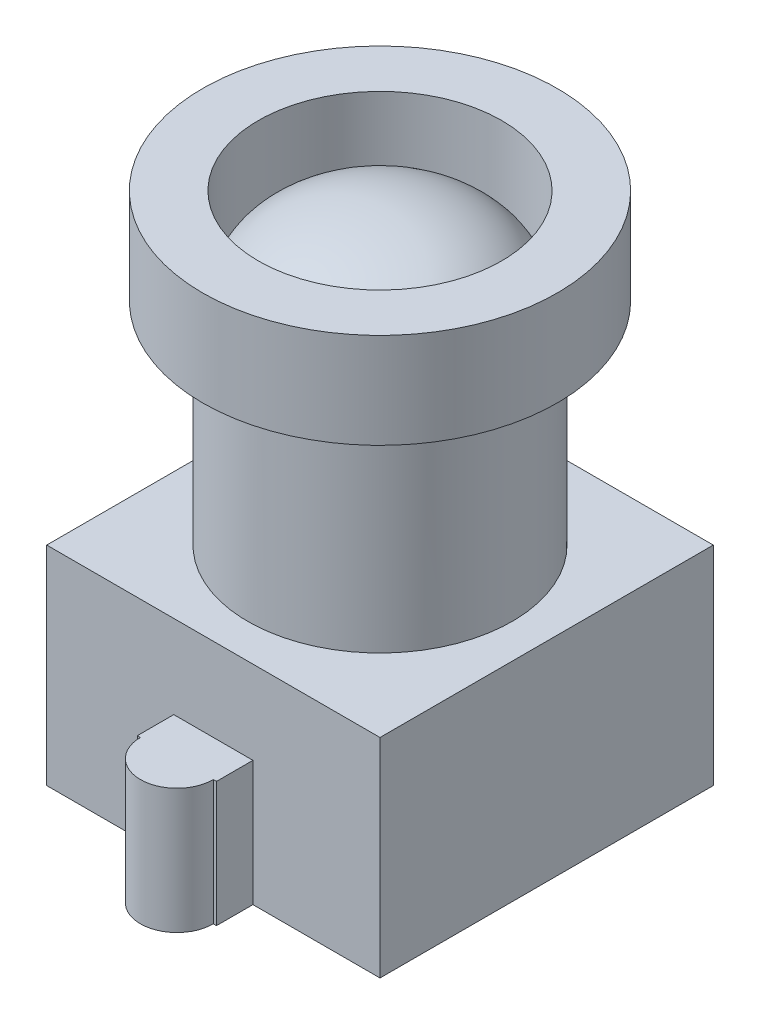
from build123d import *

# Parameters (mm, degrees)
SKETCH1_W               = 16
SKETCH1_H               = 16
CCD_BASE_DEPTH          = 10
CCD_BASE_MOUNT_DEPTH    = 6
SKETCH5_R               = 6.35
LENSE_TUBE_DEPTH        = 10.16
SKETCH6_R               = 8.509
SKETCH6_R_2             = 5.842
LENSE_RIM_DEPTH         = 4.572
LENSE_GLASS_FACE_RADIUS = 5.842
LENSE_GLASS_HEIGHT      = 3.81


with BuildPart() as part:
    # Sketch1 → ccd_base (new body)
    with BuildSketch(Plane.XZ.offset(-1.6)):
        Rectangle(SKETCH1_W, SKETCH1_H)
    extrude(amount=-CCD_BASE_DEPTH)

    # Sketch2 → ccd_base_mount (add)
    with BuildSketch(Plane.XZ.offset(-1.6)):
        with BuildLine():
            Line((1.9, 9.75), (1.75, 9.75))
            ThreePointArc((1.75, 9.75), (0, 11.5), (-1.75, 9.75))
            Line((-1.75, 9.75), (-1.9, 9.75))
            Line((-1.9, 9.75), (-1.9, 8))
            Line((-1.9, 8), (1.9, 8))
            Line((1.9, 8), (1.9, 9.75))
        make_face()
    ccd_base_mount = extrude(amount=-CCD_BASE_MOUNT_DEPTH)

    # Mirror1: ccd_base_mount across plane
    add(ccd_base_mount.mirror(Plane.XY))

    # Sketch5 → lense_tube (add)
    with BuildSketch(Plane(origin=(0, 11.6, 0), x_dir=(1, 0, 0), z_dir=(0, 1, 0))):
        Circle(SKETCH5_R)
    extrude(amount=LENSE_TUBE_DEPTH)

    # Sketch6 → lense_rim (add)
    with BuildSketch(Plane(origin=(0, 21.76, 0), x_dir=(1, 0, 0), z_dir=(0, 1, 0))):
        Circle(SKETCH6_R)
        Circle(SKETCH6_R_2, mode=Mode.SUBTRACT)
    extrude(amount=LENSE_RIM_DEPTH)

    # lense_glass: an elliptical dome of height H over a round flat face of radius A is half a spheroid: the quarter ellipse of half axes A and H revolved about the face's axis
    with BuildSketch(Plane((0, 21.76, 0), x_dir=(0, 0, -1), z_dir=(1, 0, 0)), mode=Mode.PRIVATE) as lense_glass_quarter:
        Ellipse(LENSE_GLASS_FACE_RADIUS, LENSE_GLASS_HEIGHT)
        Rectangle(LENSE_GLASS_FACE_RADIUS, LENSE_GLASS_HEIGHT, align=(Align.MIN, Align.MIN), mode=Mode.INTERSECT)
    revolve(lense_glass_quarter.sketch, axis=Axis((0, 21.76, 0), (0, 1, 0)))


solid = part.part
